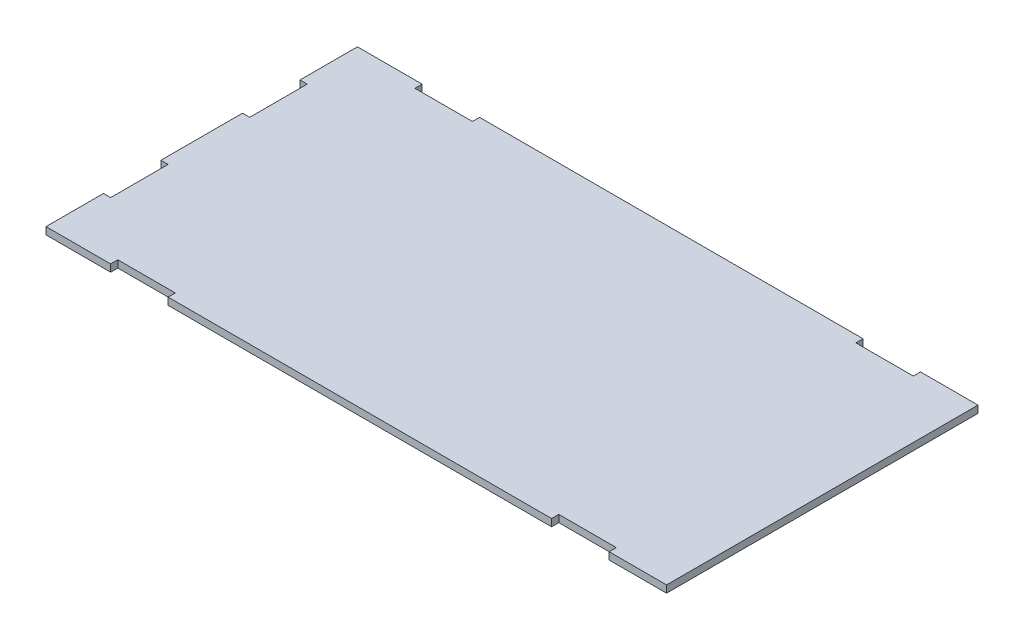
from build123d import *

# Parameters (mm, degrees)
BOSS_EXTRUDE1_DEPTH = 3.175


with BuildPart() as part:
    # Sketch1 → Boss-Extrude1 (new body)
    with BuildSketch(Plane(origin=(0, 0, 0), x_dir=(1, 0, 0), z_dir=(0, 1, 0))):
        Polygon((-137.16, 68.834), (-108.585, 68.834), (-108.585, 65.659), (-83.185, 65.659), (-83.185, 68.834), (86.36, 68.834), (86.36, 65.659), (111.76, 65.659), (111.76, 68.834), (137.16, 68.834), (137.16, -68.834), (111.76, -68.834), (111.76, -65.659), (86.36, -65.659), (86.36, -68.834), (-83.185, -68.834), (-83.185, -65.659), (-108.585, -65.659), (-108.585, -68.834), (-137.16, -68.834), (-137.16, -43.434), (-133.985, -43.434), (-133.985, -18.034), (-137.16, -18.034), (-137.16, 18.034), (-133.985, 18.034), (-133.985, 43.434), (-137.16, 43.434), align=None)
    extrude(amount=BOSS_EXTRUDE1_DEPTH)


solid = part.part
